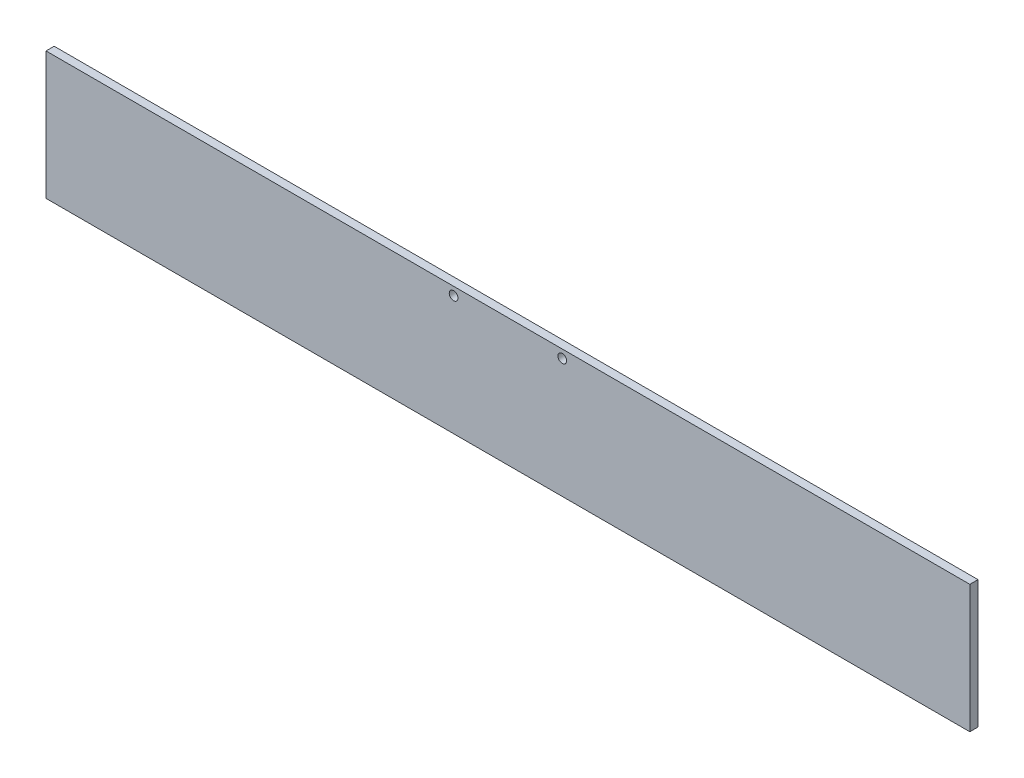
from build123d import *

# Parameters (mm, degrees)
SKETCH1_W           = 340
SKETCH1_H           = 47
BOSS_EXTRUDE1_DEPTH = 3
CUT_EXTRUDE1_REACH  = 345.246
SKETCH2_R           = 1.6


with BuildPart() as part:
    # Sketch1 → Boss-Extrude1 (new body)
    with BuildSketch(Plane.XY):
        with Locations((170, 23.5)):
            Rectangle(SKETCH1_W, SKETCH1_H)
    extrude(amount=BOSS_EXTRUDE1_DEPTH)

    # Sketch2 → Cut-Extrude1 (cut, up to next)
    with BuildSketch(Plane(origin=(0, 0, 0), x_dir=(-1, 0, 0), z_dir=(0, 0, -1)), mode=Mode.PRIVATE) as cut_extrude1_sk1:
        with Locations((-150, 44)):
            Circle(SKETCH2_R)
    cut_extrude1_tool1 = extrude(cut_extrude1_sk1.sketch, amount=-CUT_EXTRUDE1_REACH, mode=Mode.PRIVATE) & part.part
    # Sketch2 → Cut-Extrude1 (cut, up to next)
    with BuildSketch(Plane(origin=(0, 0, 0), x_dir=(-1, 0, 0), z_dir=(0, 0, -1)), mode=Mode.PRIVATE) as cut_extrude1_sk2:
        with Locations((-190, 44)):
            Circle(SKETCH2_R)
    cut_extrude1_tool2 = extrude(cut_extrude1_sk2.sketch, amount=-CUT_EXTRUDE1_REACH, mode=Mode.PRIVATE) & part.part
    add(cut_extrude1_tool1.solids().sort_by_distance((150, 44, 0))[0], mode=Mode.SUBTRACT)
    add(cut_extrude1_tool2.solids().sort_by_distance((190, 44, 0))[0], mode=Mode.SUBTRACT)


solid = part.part
